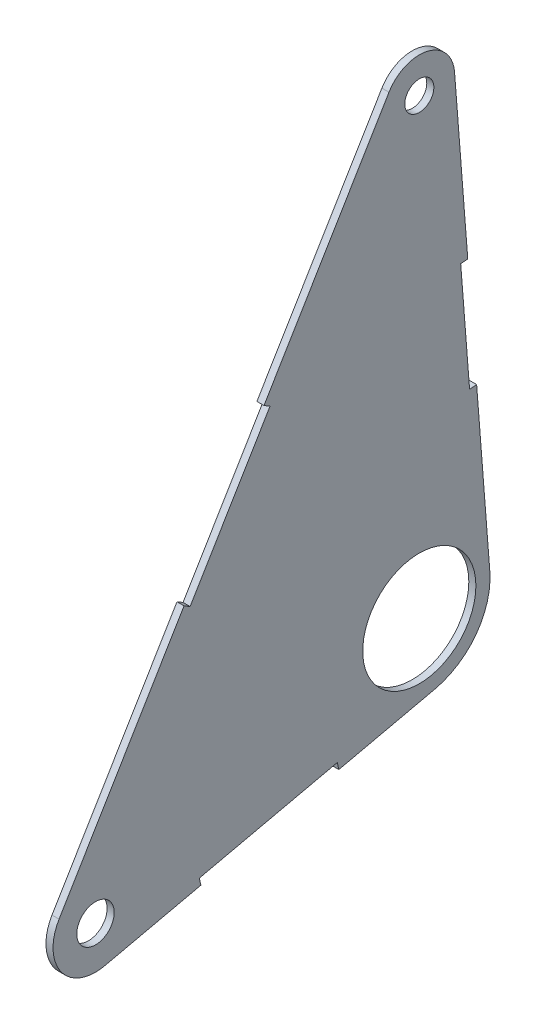
from build123d import *

# Parameters (mm, degrees)
SKETCH1_R               = 12.7
BOSS_EXTRUDE1_DEPTH     = 1.5875
F_1_4_CLEARANCE_HOLE1_D = 6.5278
M8_CLEARANCE_HOLE1_D    = 8.4


with BuildPart() as part:
    # Sketch1 → Boss-Extrude1 (new body)
    with BuildSketch(Plane(origin=(0, 0, 0), x_dir=(0, 0, -1), z_dir=(1, 0, 0))):
        with BuildLine():
            ThreePointArc((-80.846201942, -18.022137868), (-80.387968629, -28.500235027), (-70.57598428, -32.205023953))
            Line((-70.57598428, -32.205023953), (-49.025689387, -27.340625947))
            Line((-49.025689387, -27.340625947), (-49.375230615, -25.792085609))
            Line((-49.375230615, -25.792085609), (-18.404423844, -18.801261053))
            Line((-18.404423844, -18.801261053), (-18.054882616, -20.349801392))
            Line((-18.054882616, -20.349801392), (3.495412278, -15.485403385))
            ThreePointArc((3.495412278, -15.485403385), (12.777738929, -9.420457147), (15.826479195, 1.240234375))
            Line((15.826479195, 1.240234375), (12.865088743, 39.030175781))
            Line((12.865088743, 39.030175781), (11.282440824, 38.906152344))
            Line((11.282440824, 38.906152344), (9.291982129, 64.306152344))
            Line((9.291982129, 64.306152344), (10.874630048, 64.430175781))
            Line((10.874630048, 64.430175781), (7.913239597, 102.220117187))
            ThreePointArc((7.913239597, 102.220117187), (1.813907244, 109.327460563), (-6.810808579, 105.676370045))
            Line((-6.810808579, 105.676370045), (-34.860491161, 58.810894963))
            Line((-34.860491161, 58.810894963), (-33.498329446, 57.995620954))
            Line((-33.498329446, 57.995620954), (-51.434357644, 28.028063205))
            Line((-51.434357644, 28.028063205), (-52.79651936, 28.843337214))
            Line((-52.79651936, 28.843337214), (-80.846201942, -18.022137868))
        make_face()
        Circle(SKETCH1_R, mode=Mode.SUBTRACT)
    extrude(amount=BOSS_EXTRUDE1_DEPTH)

    # 1/4 Clearance Hole1 (through all)
    with Locations(Plane(origin=(1.5875, 0, 0), x_dir=(0, 0, -1), z_dir=(1, 0, 0))):
        with Locations((0, 101.6)):
            Hole(F_1_4_CLEARANCE_HOLE1_D / 2)

    # M8 Clearance Hole1 (through all)
    with Locations(Plane(origin=(1.5875, 0, 0), x_dir=(0, 0, -1), z_dir=(1, 0, 0))):
        with Locations((-72.673231647, -22.913781922)):
            Hole(M8_CLEARANCE_HOLE1_D / 2)


solid = part.part
